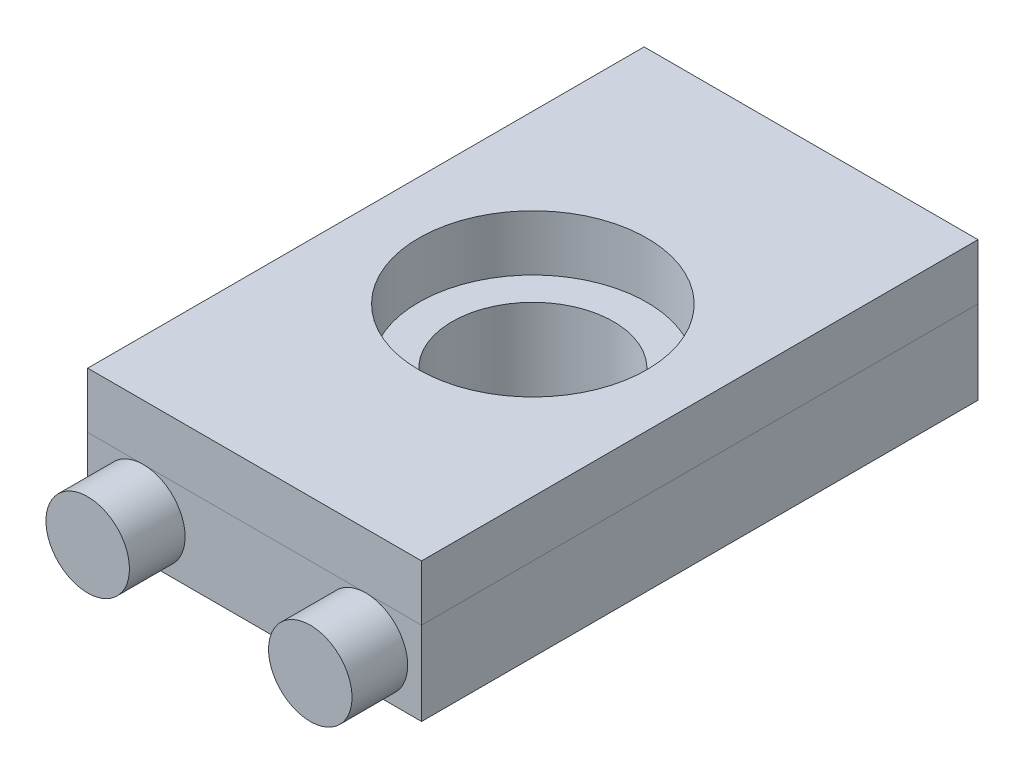
from build123d import *

# Parameters (mm, degrees)
SKETCH_1_W      = 12
SKETCH_1_H      = 20
SKETCH_1_R      = 2.9
EXTRUDE_1_DEPTH = 3
SKETCH_3_W      = 12
SKETCH_3_H      = 20
SKETCH_3_R      = 4.1
EXTRUDE_2_DEPTH = 2
SKETCH_7_R      = 1.5
EXTRUDE_3_DEPTH = 2


with BuildPart() as part:
    # 草图1 → 凸台-拉伸1 (new body)
    with BuildSketch(Plane(origin=(0, 0, 0), x_dir=(1, 0, 0), z_dir=(0, 1, 0))):
        with Locations((6, 10)):
            Rectangle(SKETCH_1_W, SKETCH_1_H)
        with Locations(Location((6, 10, 0), (0, 0, 270))):
            Circle(SKETCH_1_R, mode=Mode.SUBTRACT)
    extrude(amount=EXTRUDE_1_DEPTH)

    # 草图7 → 凸台-拉伸3 (add)
    with BuildSketch(Plane.XY):
        with Locations(Location((2, 1.5, 0), (0, 0, 270))):
            Circle(SKETCH_7_R)
        with Locations(Location((10, 1.5, 0), (0, 0, 180))):
            Circle(SKETCH_7_R)
    extrude(amount=EXTRUDE_3_DEPTH)


with BuildPart() as body_2:
    # 草图3 → 凸台-拉伸2 (new body)
    with BuildSketch(Plane(origin=(0, 3, 0), x_dir=(1, 0, 0), z_dir=(0, 1, 0))):
        with Locations((6, 10)):
            Rectangle(SKETCH_3_W, SKETCH_3_H)
        with Locations(Location((6, 10, 0), (0, 0, 270))):
            Circle(SKETCH_3_R, mode=Mode.SUBTRACT)
    extrude(amount=EXTRUDE_2_DEPTH)


solid = Compound([part.part, body_2.part])
